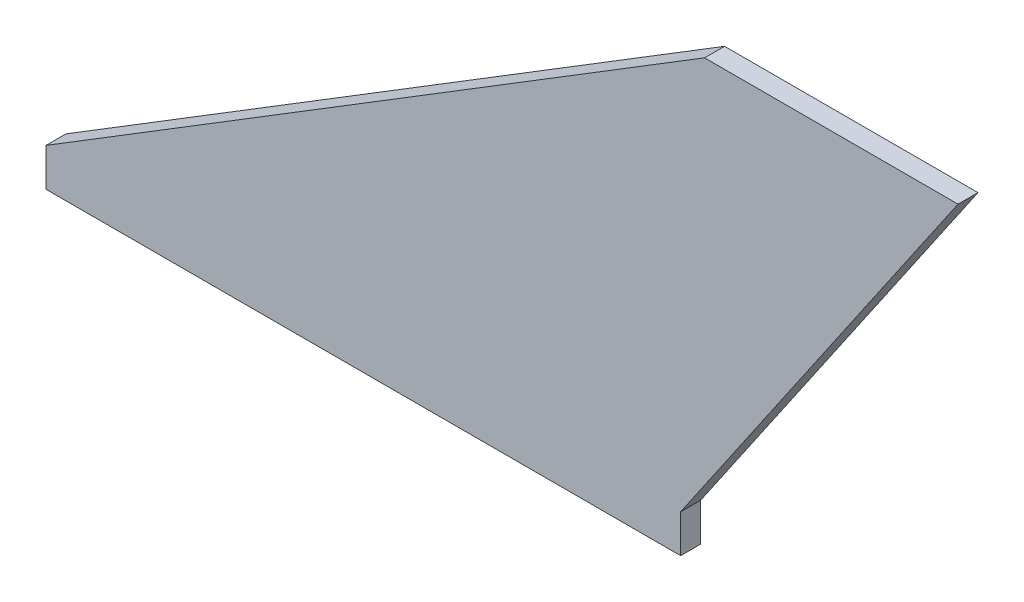
from build123d import *

# Parameters (mm, degrees)
BOSS_EXTRUDE1_DEPTH = 10


with BuildPart() as part:
    # Sketch1 → Boss-Extrude1 (new body)
    with BuildSketch(Plane.XY):
        Polygon((0, 0), (318, 0), (318, 19.05), (457, 222.05), (330, 222.05), (0, 19.05), align=None)
    extrude(amount=BOSS_EXTRUDE1_DEPTH)


solid = part.part
